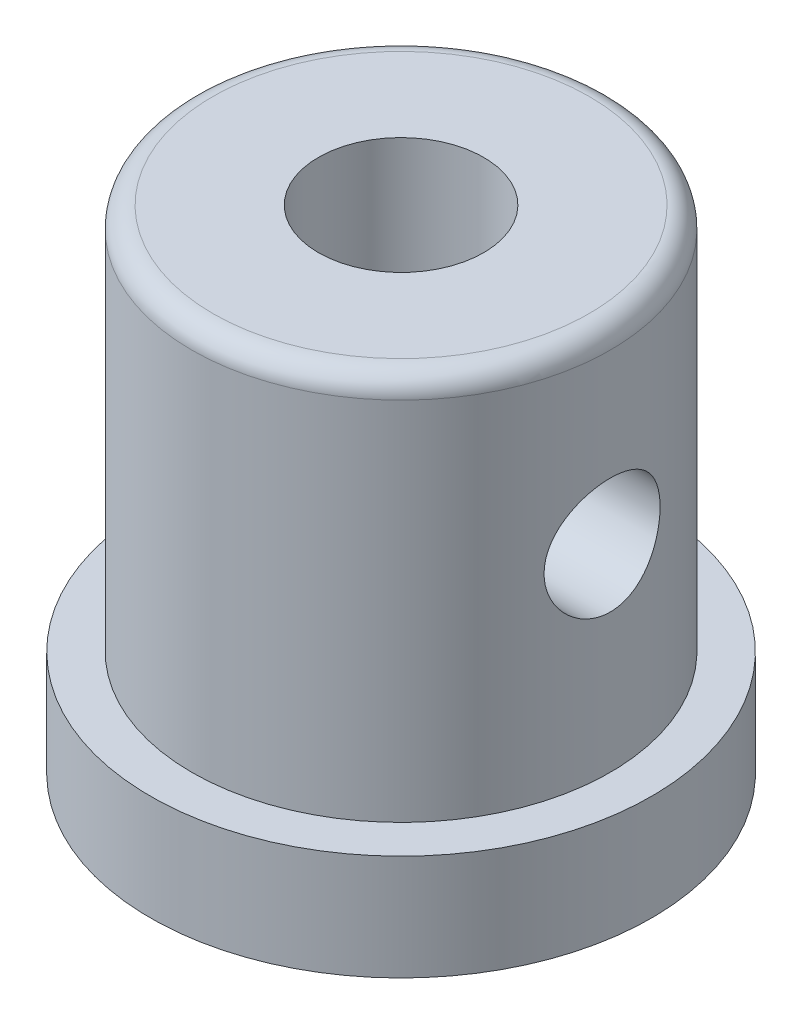
from build123d import *

# Parameters (mm, degrees)
SKETCH1_R                           = 9.05
PLATE_DEPTH                         = 3.81
SKETCH1_3_R                         = 7.5565
PLUG_DEPTH                          = 17.78
CUT_EXTRUDE1_REACH                  = 23.907
CUT_EXTRUDE1_END_RADIUS             = 7.5565
SKETCH4_R                           = 2.0955
CUT_EXTRUDE1_DIRECTION_2_REACH      = 23.907
CUT_EXTRUDE1_DIRECTION_2_END_RADIUS = 7.5565
FILLET1_R                           = 0.762
CUT_EXTRUDE2_REACH                  = 23.907
SKETCH5_R                           = 2.9845


with BuildPart() as part:
    # Sketch1 → Plate (new body)
    with BuildSketch(Plane(origin=(0, 0, 0), x_dir=(1, 0, 0), z_dir=(0, 1, 0))):
        Circle(SKETCH1_R)
    extrude(amount=PLATE_DEPTH)

    # Sketch1<3> → Plug (add)
    with BuildSketch(Plane(origin=(0, 0, 0), x_dir=(1, 0, 0), z_dir=(0, 1, 0))):
        Circle(SKETCH1_3_R)
    extrude(amount=PLUG_DEPTH)

    # Cut-Extrude1: up to this cylinder (the profile starts inside it)
    cut_extrude1_end = Plane(origin=(0, 10.922, 0), z_dir=(0, -1, 0)) * Cylinder(CUT_EXTRUDE1_END_RADIUS, 63.927, mode=Mode.PRIVATE)
    # Sketch4 → Cut-Extrude1 (cut, up to the surface)
    with BuildSketch(Plane(origin=(0, 0, 0), x_dir=(0, 0, -1), z_dir=(1, 0, 0)), mode=Mode.PRIVATE) as cut_extrude1_sk1:
        with Locations((0, 10.922)):
            Circle(SKETCH4_R)
    cut_extrude1_tool1 = extrude(cut_extrude1_sk1.sketch, amount=-CUT_EXTRUDE1_REACH, mode=Mode.PRIVATE) & cut_extrude1_end
    add(cut_extrude1_tool1.solids().sort_by_distance((0, 10.922, 0))[0], mode=Mode.SUBTRACT)

    # Cut-Extrude1 direction 2: up to this cylinder (the profile starts inside it)
    cut_extrude1_direction_2_end = Plane(origin=(0, 10.922, 0), z_dir=(0, -1, 0)) * Cylinder(CUT_EXTRUDE1_DIRECTION_2_END_RADIUS, 63.927, mode=Mode.PRIVATE)
    # Sketch4 → Cut-Extrude1 direction 2 (cut, up to the surface)
    with BuildSketch(Plane(origin=(0, 0, 0), x_dir=(0, 0, -1), z_dir=(1, 0, 0)), mode=Mode.PRIVATE) as cut_extrude1_direction_2_sk1:
        with Locations((0, 10.922)):
            Circle(SKETCH4_R)
    cut_extrude1_direction_2_tool1 = extrude(cut_extrude1_direction_2_sk1.sketch, amount=CUT_EXTRUDE1_DIRECTION_2_REACH, mode=Mode.PRIVATE) & cut_extrude1_direction_2_end
    add(cut_extrude1_direction_2_tool1.solids().sort_by_distance((0, 10.922, 0))[0], mode=Mode.SUBTRACT)

    # Fillet1
    fillet1_edges = [part.edges().sort_by_distance(p)[0] for p in [
        (-7.5565, 17.78, 0),
    ]]
    fillet(fillet1_edges, radius=FILLET1_R)

    # Sketch5 → Cut-Extrude2 (cut, up to next)
    with BuildSketch(Plane(origin=(0, 17.78, 0), x_dir=(1, 0, 0), z_dir=(0, 1, 0)), mode=Mode.PRIVATE) as cut_extrude2_sk1:
        Circle(SKETCH5_R)
    cut_extrude2_tool1 = extrude(cut_extrude2_sk1.sketch, amount=-CUT_EXTRUDE2_REACH, mode=Mode.PRIVATE) & part.part
    add(cut_extrude2_tool1.solids().sort_by_distance((0, 17.78, 0))[0], mode=Mode.SUBTRACT)


solid = part.part
